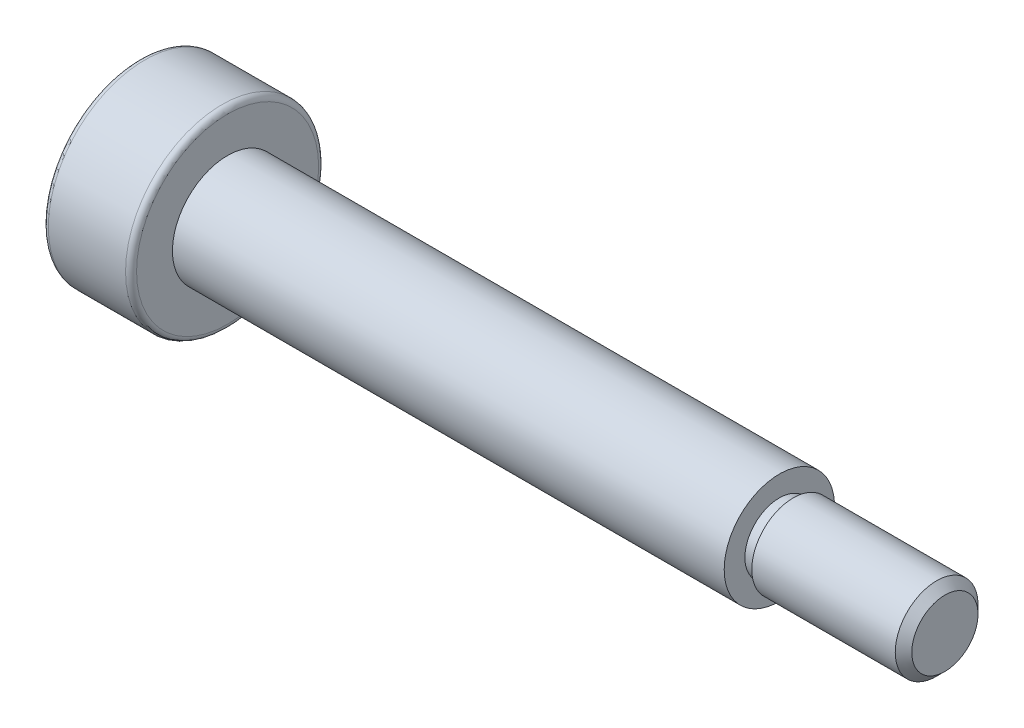
from build123d import *

# Parameters (mm, degrees)
FILLET_1_R          = 0.2
CHAMFER_1_SIZE      = 0.3
SKETCH_3_W          = 0.5
SKETCH_3_H          = 0.25
CUT_EXTRUDE_1_DEPTH = 2


with BuildPart() as part:
    # 草图1 → 旋转1 (revolve)
    with BuildSketch(Plane.XY, mode=Mode.PRIVATE) as revolve_1_sk:
        Polygon((-14.6, 0), (-14.6, 3.5), (-11.4, 3.5), (-11.4, 2), (8.6, 2), (8.6, 1.5), (14.6, 1.5), (14.6, 0), align=None)
    revolve(revolve_1_sk.sketch.rotate(Axis((-14.6, 0, 0), (1, 0, 0)), 90), axis=Axis((-14.6, 0, 0), (1, 0, 0)))

    # 圆角1
    fillet_1_edges = [part.edges().sort_by_distance(p)[0] for p in [
        (-11.4, 0, -3.5),
        (-14.6, 0, -3.5),
    ]]
    fillet(fillet_1_edges, radius=FILLET_1_R)

    # 倒角1
    chamfer_1_edges = [part.edges().sort_by_distance(p)[0] for p in [
        (14.6, 0, -1.5),
    ]]
    chamfer(chamfer_1_edges, length=CHAMFER_1_SIZE)

    # 草图3 → 切除-旋转1 (revolve, cut)
    with BuildSketch(Plane.XY, mode=Mode.PRIVATE) as cut_revolve_1_sk:
        with Locations((8.85, 1.375)):
            Rectangle(SKETCH_3_W, SKETCH_3_H)
    revolve(cut_revolve_1_sk.sketch.rotate(Axis((8.6, 0, 0), (1, 0, 0)), 90), axis=Axis((8.6, 0, 0), (1, 0, 0)), mode=Mode.SUBTRACT)

    # 草图4 → 切除-拉伸1 (cut)
    with BuildSketch(Plane.ZY.offset(14.6)):
        Polygon((1.732050808, 0), (0.866025404, 1.5), (-0.866025404, 1.5), (-1.732050808, 0), (-0.866025404, -1.5), (0.866025404, -1.5), align=None)
    extrude(amount=-CUT_EXTRUDE_1_DEPTH, mode=Mode.SUBTRACT)


solid = part.part
